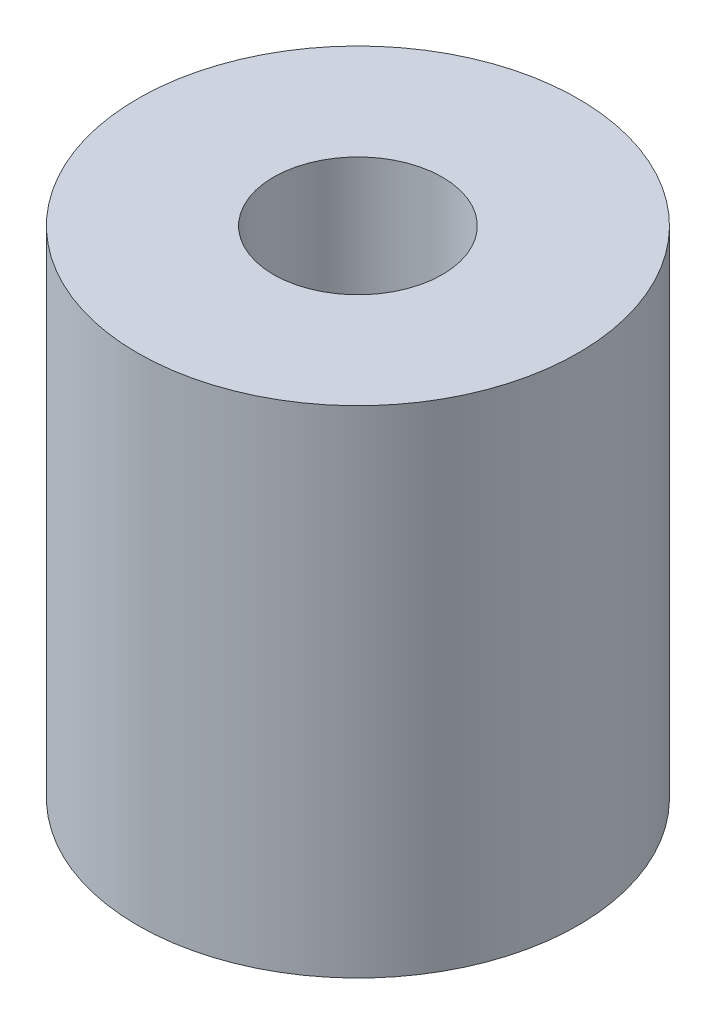
from build123d import *

# Parameters (mm, degrees)
SKETCH1_R           = 6
SKETCH1_R_2         = 2.3
BOSS_EXTRUDE1_DEPTH = 13.5


with BuildPart() as part:
    # Sketch1 → Boss-Extrude1 (new body)
    with BuildSketch(Plane(origin=(0, 0, 0), x_dir=(1, 0, 0), z_dir=(0, 1, 0))):
        with Locations(Location((0, 0, 0), (0, 0, 270))):
            Circle(SKETCH1_R)
        with Locations(Location((0, 0, 0), (0, 0, 270))):
            Circle(SKETCH1_R_2, mode=Mode.SUBTRACT)
    extrude(amount=BOSS_EXTRUDE1_DEPTH)


solid = part.part
